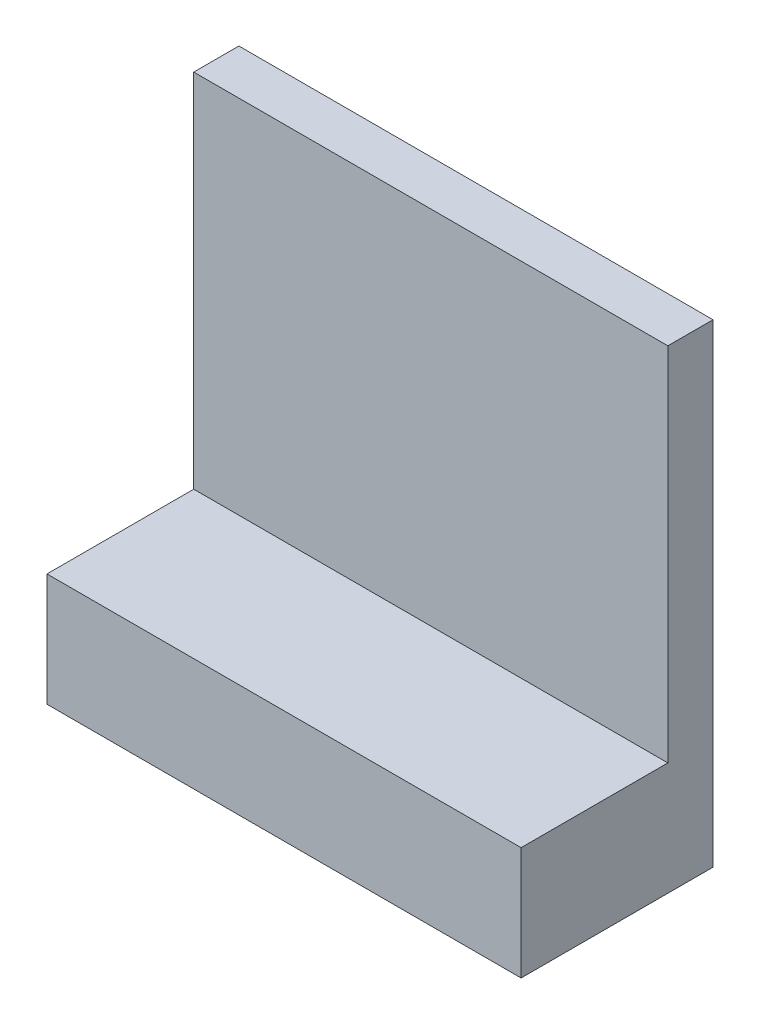
from build123d import *

# Parameters (mm, degrees)
SKETCH1_W           = 42
SKETCH1_H           = 42
BOSS_EXTRUDE1_DEPTH = 17
SKETCH2_W           = 42
SKETCH2_H           = 32
CUT_EXTRUDE1_DEPTH  = 13


with BuildPart() as part:
    # Sketch1 → Boss-Extrude1 (new body)
    with BuildSketch(Plane.XY):
        Rectangle(SKETCH1_W, SKETCH1_H)
    extrude(amount=BOSS_EXTRUDE1_DEPTH)

    # Sketch2 → Cut-Extrude1 (cut)
    with BuildSketch(Plane.XY.offset(17)):
        with Locations((0, 5)):
            Rectangle(SKETCH2_W, SKETCH2_H)
    extrude(amount=-CUT_EXTRUDE1_DEPTH, mode=Mode.SUBTRACT)


solid = part.part
